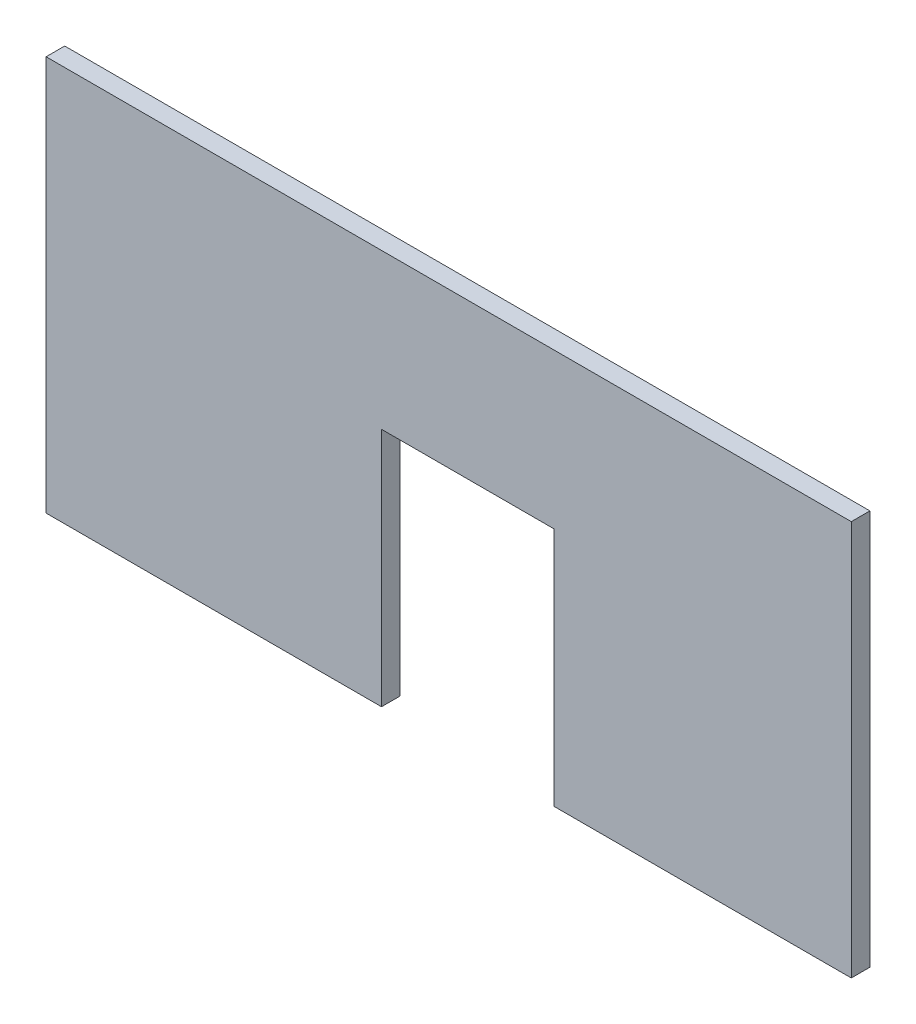
from build123d import *

# Parameters (mm, degrees)
BOSS_EXTRUDE1_START = 48
BOSS_EXTRUDE1_DEPTH = 10


with BuildPart() as part:
    # Sketch1 → Boss-Extrude1 (new body)
    with BuildSketch(Plane.XY.offset(BOSS_EXTRUDE1_START)):
        Polygon((-35.751247902, 1576.485487398), (-35.751247902, 1705.542913165), (56.982876999, 1705.542913165), (56.982876999, 1576.485487398), (216.535268781, 1576.485487398), (216.535268781, 1788.738422577), (-215.875298803, 1788.738422577), (-215.875298803, 1576.485487398), align=None)
    extrude(amount=BOSS_EXTRUDE1_DEPTH)


solid = part.part
